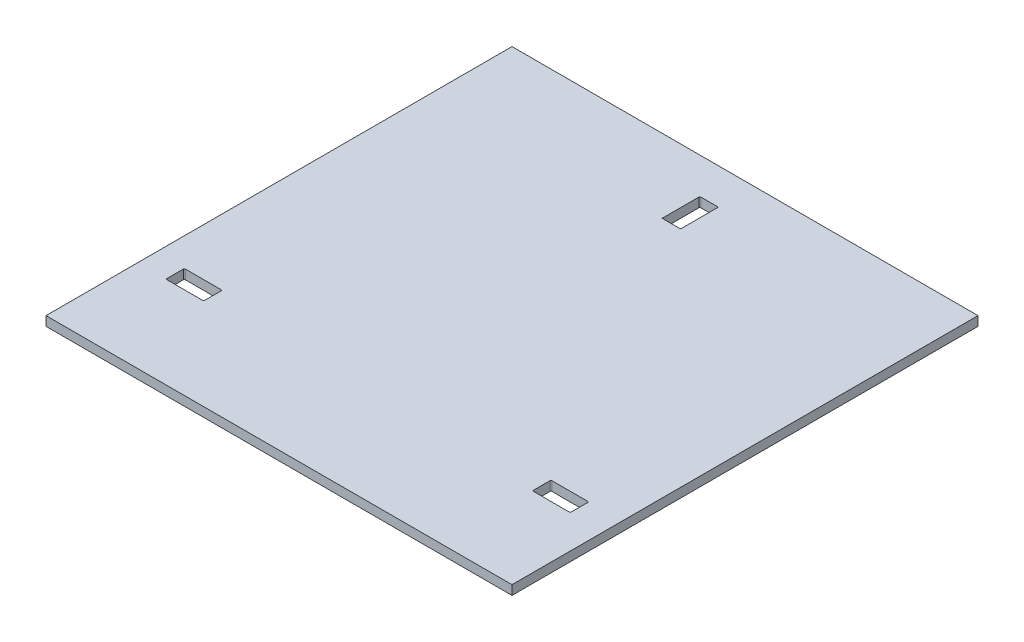
from build123d import *

# Parameters (mm, degrees)
CROQUIS1_W              = 500
CROQUIS1_H              = 500
SALIENTE_EXTRUIR1_DEPTH = 10
CROQUIS22_W             = 40.5
CROQUIS22_H             = 19.8
CROQUIS22_W_2           = 19.8
CROQUIS22_H_2           = 40.5
CORTAR_EXTRUIR1_DEPTH   = 10
REDONDEO1_R             = 1


with BuildPart() as part:
    # Croquis1 → Saliente-Extruir1 (new body)
    with BuildSketch(Plane(origin=(0, 0, 0), x_dir=(1, 0, 0), z_dir=(0, 1, 0))):
        with Locations((250, 250)):
            Rectangle(CROQUIS1_W, CROQUIS1_H)
    extrude(amount=SALIENTE_EXTRUIR1_DEPTH)

    # Croquis22 → Cortar-Extruir1 (cut)
    with BuildSketch(Plane(origin=(0, 10, 0), x_dir=(1, 0, 0), z_dir=(0, 1, 0))):
        with Locations((50.671999964, 108.122675133)):
            Rectangle(CROQUIS22_W, CROQUIS22_H)
        with Locations((444.021393457, 108.122675133)):
            Rectangle(CROQUIS22_W, CROQUIS22_H)
        with Locations((250, 441.225372138)):
            Rectangle(CROQUIS22_W_2, CROQUIS22_H_2)
    extrude(amount=-CORTAR_EXTRUIR1_DEPTH, mode=Mode.SUBTRACT)

    # Redondeo1
    redondeo1_edges = [part.edges().sort_by_distance(p)[0] for p in [
        (30.421999964, 5, -98.222675133),
        (30.421999964, 5, -118.022675133),
        (70.921999964, 5, -118.022675133),
        (70.921999964, 5, -98.222675133),
        (423.771393457, 5, -98.222675133),
        (423.771393457, 5, -118.022675133),
        (464.271393457, 5, -118.022675133),
        (464.271393457, 5, -98.222675133),
        (240.1, 5, -461.475372138),
        (259.9, 5, -461.475372138),
        (259.9, 5, -420.975372138),
    ]]
    fillet(redondeo1_edges, radius=REDONDEO1_R)


solid = part.part
